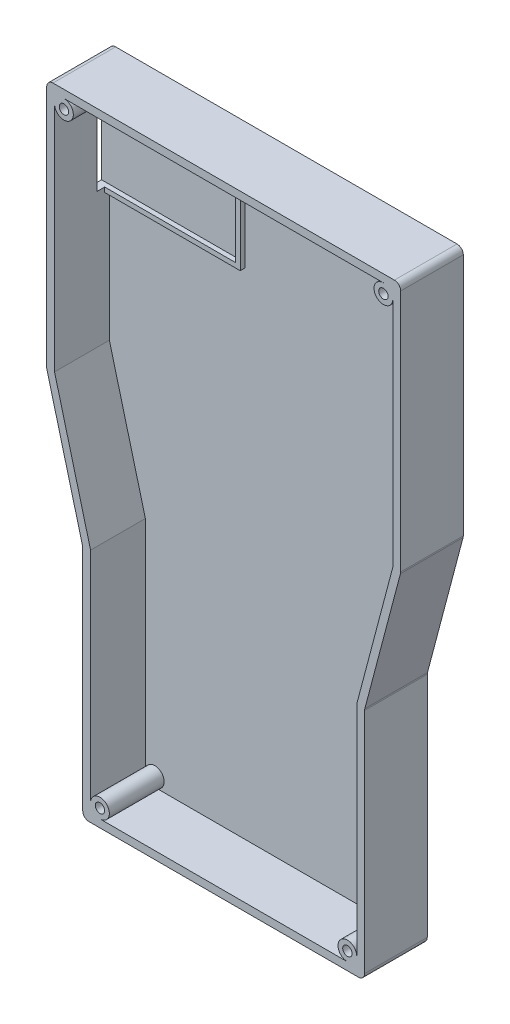
from build123d import *

# Parameters (mm, degrees)
BOSS_EXTRUDE1_DEPTH = 20
SHELL1_T            = -2.5
FILLET1_R           = 2
BOSS_EXTRUDE2_DEPTH = 17.5
SKETCH4_R           = 1.5
CUT_EXTRUDE1_DEPTH  = 208.327218727
BOSS_EXTRUDE3_DEPTH = 1.5
CUT_EXTRUDE2_REACH  = 231.263
SKETCH6_W           = 4
SKETCH6_H           = 24


with BuildPart() as part:
    # Sketch1 → Boss-Extrude1 (new body)
    with BuildSketch(Plane.XY):
        Polygon((-45, -123.475), (-45, -198.475), (45, -198.475), (45, -123.475), (56.5, -79.95), (56.5, 0), (-56.5, 0), (-56.5, -79.95), align=None)
    extrude(amount=BOSS_EXTRUDE1_DEPTH)

    # Shell1
    shell1_openings = [part.faces().sort_by_distance(p)[0] for p in [
        (0, -93.724865495, 20),
    ]]
    offset(amount=SHELL1_T, openings=shell1_openings, kind=Kind.INTERSECTION)

    # Fillet1
    fillet1_edges = [part.edges().sort_by_distance(p)[0] for p in [
        (-56.5, -79.95, 10),
        (-56.5, 0, 10),
        (56.5, 0, 10),
        (56.5, -79.95, 10),
        (45, -123.475, 10),
        (45, -198.475, 10),
        (-45, -198.475, 10),
        (-45, -123.475, 10),
    ]]
    fillet(fillet1_edges, radius=FILLET1_R)

    # Sketch2 → Boss-Extrude2 (add, through all)
    with BuildSketch(Plane.XY.offset(2.5)):
        with BuildLine():
            Line((54, -5.5), (54, -2.5))
            Line((54, -2.5), (51, -2.5))
            ThreePointArc((51, -2.5), (48.878679656, -7.621320344), (54, -5.5))
        make_face()
        with BuildLine():
            Line((42.5, -195.975), (42.5, -192.975))
            ThreePointArc((42.5, -192.975), (37.378679656, -190.853679656), (39.5, -195.975))
            Line((39.5, -195.975), (42.5, -195.975))
        make_face()
        with BuildLine():
            Line((-39.5, -195.975), (-42.5, -195.975))
            Line((-42.5, -195.975), (-42.5, -192.975))
            ThreePointArc((-42.5, -192.975), (-37.378679656, -190.853679656), (-39.5, -195.975))
        make_face()
        with BuildLine():
            Line((-54, -2.5), (-51, -2.5))
            ThreePointArc((-51, -2.5), (-48.878679656, -7.621320344), (-54, -5.5))
            Line((-54, -5.5), (-54, -2.5))
        make_face()
    extrude(amount=BOSS_EXTRUDE2_DEPTH)

    # Sketch4 → Cut-Extrude1 (cut, through all)
    with BuildSketch(Plane.XY.offset(20)):
        with Locations((51, -5.5)):
            Circle(SKETCH4_R)
        with Locations((39.5, -192.975)):
            Circle(SKETCH4_R)
        with Locations(Location((-39.5, -192.975, 0), (0, 0, 180))):
            Circle(SKETCH4_R)
        with Locations(Location((-51, -5.5, 0), (0, 0, 180))):
            Circle(SKETCH4_R)
    extrude(amount=-CUT_EXTRUDE1_DEPTH, mode=Mode.SUBTRACT)

    # Sketch5 → Boss-Extrude3 (add)
    with BuildSketch(Plane.XY.offset(2.5)):
        Polygon((-54, -11), (-54, -12.5), (-12.2, -12.5), (-12.2, -36.5), (-54, -36.5), (-54, -38), (-10.7, -38), (-10.7, -11), align=None)
    extrude(amount=BOSS_EXTRUDE3_DEPTH)

    # Sketch6 → Cut-Extrude2 (cut, up to next)
    with BuildSketch(Plane.ZY.offset(56.5), mode=Mode.PRIVATE) as cut_extrude2_sk1:
        with Locations((4.5, -24.5)):
            Rectangle(SKETCH6_W, SKETCH6_H)
    cut_extrude2_tool1 = extrude(cut_extrude2_sk1.sketch, amount=-CUT_EXTRUDE2_REACH, mode=Mode.PRIVATE) & part.part
    add(cut_extrude2_tool1.solids().sort_by_distance((-56.5, -24.5, 4.5))[0], mode=Mode.SUBTRACT)


solid = part.part
